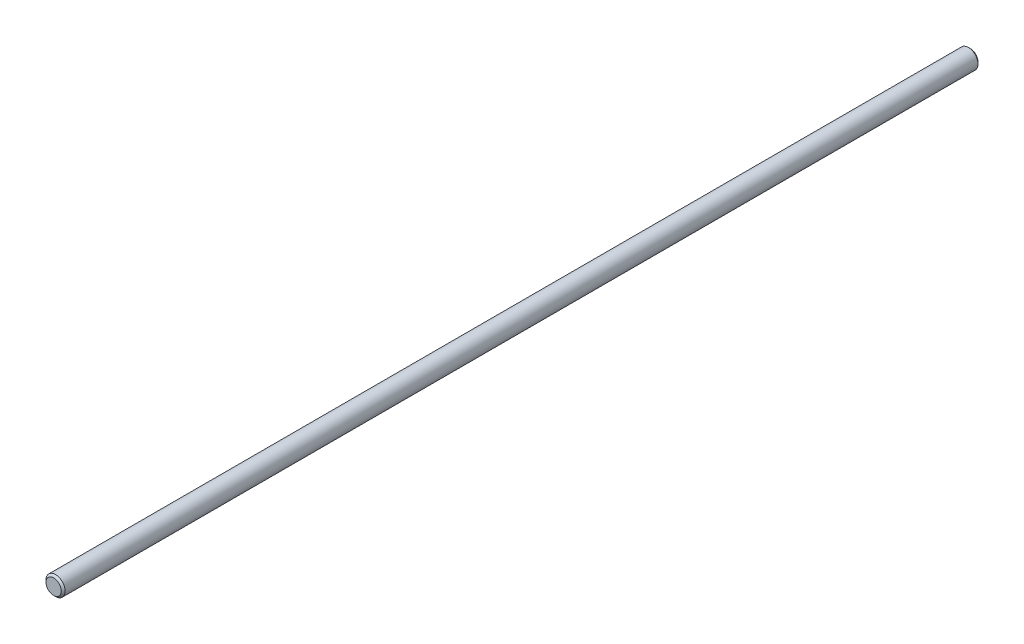
from build123d import *

# Parameters (mm, degrees)
SKETCH1_R      = 1.5875
EXTRUDE1_DEPTH = 76.2
CHAMFER1_SIZE  = 0.3175


with BuildPart() as part:
    # Sketch1 → Extrude1 (new, symmetric)
    with BuildSketch(Plane.XY):
        with Locations(Location((0, 0, 0), (0, 0, 180))):
            Circle(SKETCH1_R)
    extrude(amount=EXTRUDE1_DEPTH, both=True)

    # Chamfer1
    chamfer1_edges = [part.edges().sort_by_distance(p)[0] for p in [
        (1.5875, 0, -76.2),
        (1.5875, 0, 76.2),
    ]]
    chamfer(chamfer1_edges, length=CHAMFER1_SIZE)


solid = part.part
